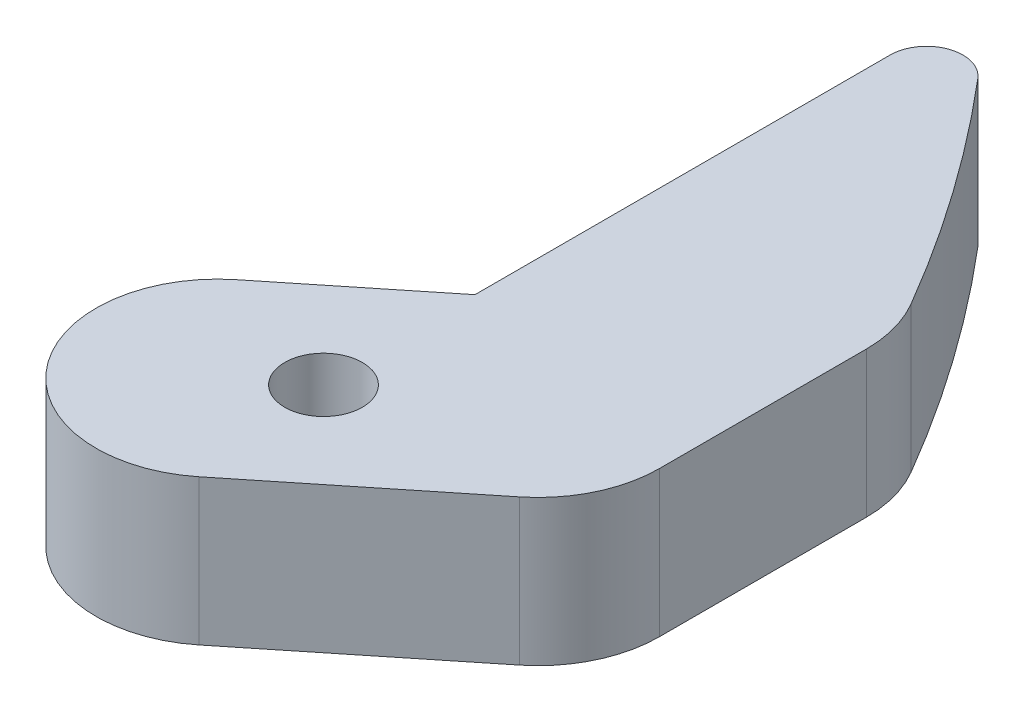
from build123d import *

# Parameters (mm, degrees)
ESBO_O1_R                = 1.6
RESSALTO_EXTRUS_O1_DEPTH = 6


with BuildPart() as part:
    # Esboço1 → Ressalto-extrusão1 (new body)
    with BuildSketch(Plane.XZ.offset(12)):
        with BuildLine():
            Line((-5.554408486, -1.950425304), (-0.098401843, -6.33585476))
            Line((-0.098401843, -6.33585476), (-0.098401843, -23.434191187))
            ThreePointArc((-0.098401843, -23.434191187), (0.884517689, -24.84224935), (2.545101876, -24.404963685))
            ThreePointArc((2.545101876, -24.404963685), (6.090429059, -19.835978921), (9.220727662, -14.973243345))
            ThreePointArc((9.220727662, -14.973243345), (9.728380083, -13.758965882), (9.901598157, -12.454291119))
            Line((9.901598157, -12.454291119), (9.901598157, -3.939806958))
            ThreePointArc((9.901598157, -3.939806958), (9.410602928, -1.779048764), (8.034047768, -0.042659356))
            Line((8.034047768, -0.042659356), (0.710490736, 5.843869901))
            ThreePointArc((0.710490736, 5.843869901), (-6.319106477, 5.07917191), (-5.554408486, -1.950425304))
        make_face()
        with Locations(Location((0, 0, 0), (0, 0, 90))):
            Circle(ESBO_O1_R, mode=Mode.SUBTRACT)
    extrude(amount=-RESSALTO_EXTRUS_O1_DEPTH)


solid = part.part
